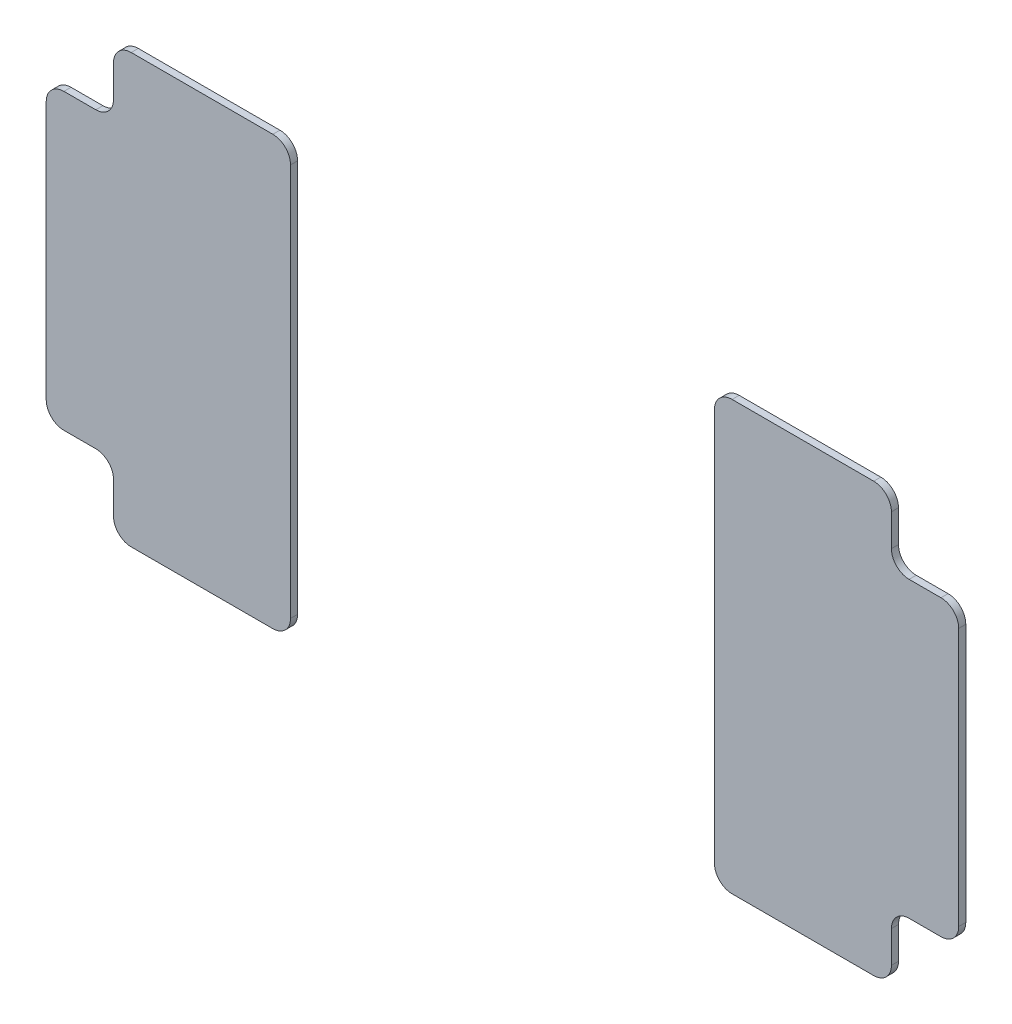
from build123d import *

# Parameters (mm, degrees)
BOSS_EXTRUDE1_DEPTH   = 2
BOSS_EXTRUDE1_2_DEPTH = 2
FILLET1_R             = 5
FILLET2_R             = 5


with BuildPart() as part:
    # Sketch24 → Boss-Extrude1 (new body)
    with BuildSketch(Plane.XY):
        Polygon((30.42227205, 29.296782196), (30.42227205, 10.286374556), (80.42227205, 10.286374556), (80.42227205, 131.238694526), (30.42227205, 131.238694526), (30.42227205, 112.228286886), (11.41186441, 112.228286886), (11.41186441, 29.296782196), align=None)
    extrude(amount=-BOSS_EXTRUDE1_DEPTH)

    # Fillet1
    fillet1_edges = [part.edges().sort_by_distance(p)[0] for p in [
        (11.41186441, 29.296782196, -1),
        (30.42227205, 29.296782196, -1),
        (30.42227205, 10.286374556, -1),
        (80.42227205, 10.286374556, -1),
        (80.42227205, 131.238694526, -1),
        (30.42227205, 131.238694526, -1),
        (30.42227205, 112.228286886, -1),
        (11.41186441, 112.228286886, -1),
    ]]
    fillet(fillet1_edges, radius=FILLET1_R)


with BuildPart() as body_2:
    # Sketch24 → Boss-Extrude1 2 (new body)
    with BuildSketch(Plane.XY):
        Polygon((269.168886442, 112.228286886), (250.158478802, 112.228286886), (250.158478802, 131.238694526), (200.158478802, 131.238694526), (200.158478802, 10.286374556), (250.158478802, 10.286374556), (250.158478802, 29.296782196), (269.168886442, 29.296782196), align=None)
    extrude(amount=-BOSS_EXTRUDE1_2_DEPTH)

    # Fillet2
    fillet2_edges = [body_2.edges().sort_by_distance(p)[0] for p in [
        (200.158478802, 131.238694526, -1),
        (250.158478802, 131.238694526, -1),
        (250.158478802, 112.228286886, -1),
        (269.168886442, 112.228286886, -1),
        (250.158478802, 29.296782196, -1),
        (269.168886442, 29.296782196, -1),
        (250.158478802, 10.286374556, -1),
        (200.158478802, 10.286374556, -1),
    ]]
    fillet(fillet2_edges, radius=FILLET2_R)


solid = Compound([part.part, body_2.part])
